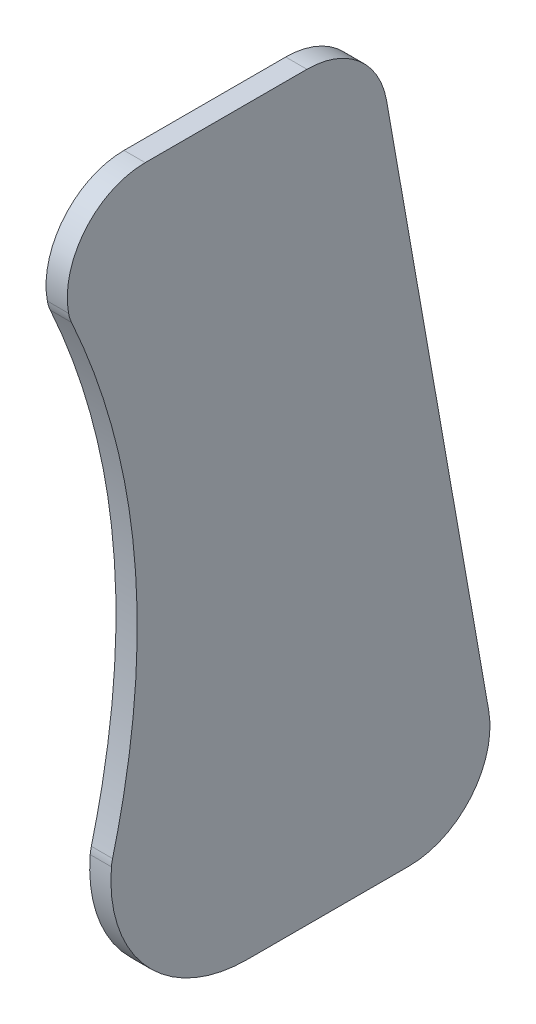
from build123d import *

# Parameters (mm, degrees)
BOSS_EXTRUDE1_DEPTH = 4
FILLET1_R           = 7.62
FILLET2_R           = 7.62


with BuildPart() as part:
    # Sketch1 → Boss-Extrude1 (new body)
    with BuildSketch(Plane(origin=(0, 0, 0), x_dir=(0, 0, -1), z_dir=(1, 0, 0))):
        with BuildLine():
            Line((-0.858815867, 31.104520152), (29.621184133, 31.104520152))
            ThreePointArc((29.621184133, 31.104520152), (41.295701446, 36.548436981), (44.629654289, 48.99091838))
            Line((44.629654289, 48.99091838), (25.371221456, 158.21091838))
            ThreePointArc((25.371221456, 158.21091838), (20.158834472, 167.239037466), (10.3627513, 170.804520152))
            Line((10.3627513, 170.804520152), (-20.1172487, 170.804520152))
            ThreePointArc((-20.1172487, 170.804520152), (-31.760723964, 165.072637938), (-34.31908063, 152.349438611))
            add(Edge.make_bspline(
                [(-34.31908063, 152.349438611), (-13.825923221, 107.792988448), (-26.416398798, 59.730007543)],
                knots=[0, 0, 0, 1, 1, 1], degree=2))
            ThreePointArc((-26.416398798, 59.730007543), (-20.046107062, 39.695587879), (-0.858815867, 31.104520152))
        make_face()
    extrude(amount=BOSS_EXTRUDE1_DEPTH)

    # Fillet1
    fillet1_edges = [part.edges().sort_by_distance(p)[0] for p in [
        (2, 152.349438611, 34.31908063),
    ]]
    fillet(fillet1_edges, radius=FILLET1_R)

    # Fillet2
    fillet2_edges = [part.edges().sort_by_distance(p)[0] for p in [
        (2, 59.730007543, 26.416398798),
    ]]
    fillet(fillet2_edges, radius=FILLET2_R)


solid = part.part
